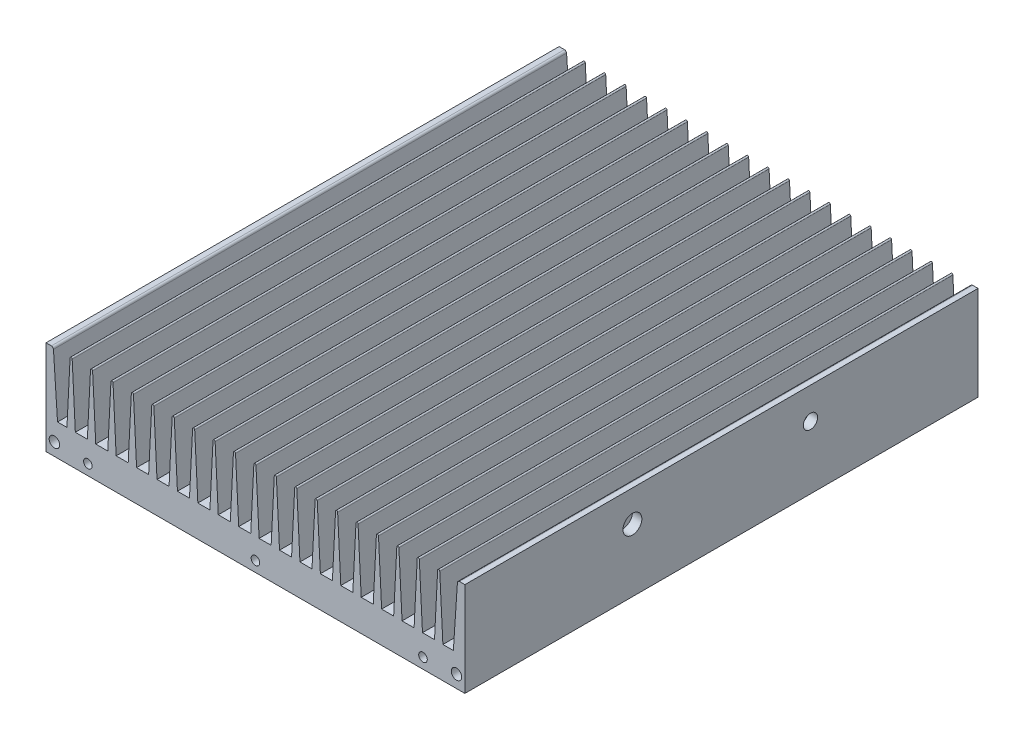
from build123d import *

# Parameters (mm, degrees)
EXTRUDE_1_DEPTH       = 245
EXTRUDE_3_DEPTH       = 245
PATTERN_CURVE_1_COUNT = 19
PATTERN_CURVE_1_PITCH = 9.75
SKETCH_3_R            = 2.05
CUT_EXTRUDE_1_DEPTH   = 10
CUT_EXTRUDE_START     = -10
SKETCH_5_R            = 2.05
CUT_EXTRUDE_2_DEPTH   = 10
SKETCH_6_R            = 2.5
CUT_EXTRUDE_3_DEPTH   = 8
SKETCH_7_R            = 2.6
CUT_EXTRUDE_4_DEPTH   = 6
SKETCH_8_R            = 3.4
SKETCH_8_R_2          = 4.5
CUT_EXTRUDE_5_DEPTH   = 6
CUT_EXTRUDE_START_2   = -8
SKETCH_10_R           = 2.5
CUT_EXTRUDE_7_DEPTH   = 8
SKETCH_12_R           = 1.3
SKETCH_12_R_2         = 1.6
SKETCH_12_R_3         = 2.1
CUT_EXTRUDE_8_DEPTH   = 8


with BuildPart() as part:
    # Эскиз1 → Вытянуть1 (new body)
    with BuildSketch(Plane.XY):
        with BuildLine():
            Line((0, 45), (2.564446908, 45))
            ThreePointArc((2.564446908, 45), (3.247630994, 44.730246195), (3.562232066, 44.066519011))
            Line((3.562232066, 44.066519011), (5.5, 15))
            Line((5.5, 15), (194.5, 15))
            Line((194.5, 15), (196.437767934, 44.066519011))
            ThreePointArc((196.437767934, 44.066519011), (196.752369006, 44.730246195), (197.435553092, 45))
            Line((197.435553092, 45), (200, 45))
            Line((200, 45), (200, 0))
            Line((200, 0), (0, 0))
            Line((0, 0), (0, 45))
        make_face()
    extrude(amount=EXTRUDE_1_DEPTH)

    # Эскиз2 → Вытянуть3 (add)
    with BuildSketch(Plane.XY.offset(245)):
        with BuildLine():
            Line((11.5, 44.5), (10, 15))
            Line((10, 15), (14, 15))
            Line((14, 15), (12.5, 44.5))
            ThreePointArc((12.5, 44.5), (12, 45), (11.5, 44.5))
        make_face()
    extrude_3 = extrude(amount=-EXTRUDE_3_DEPTH)

    # Кривая1: Вытянуть3 ×19
    with Locations(*[(i * PATTERN_CURVE_1_PITCH, 0, 0) for i in range(1, PATTERN_CURVE_1_COUNT)]):
        add(extrude_3)

    # Эскиз3 → Вырез-Вытянуть1 (cut)
    with BuildSketch(Plane.XY.offset(245)):
        with Locations((20, 5)):
            Circle(SKETCH_3_R)
        with Locations((100, 5)):
            Circle(SKETCH_3_R)
        with Locations((180, 5)):
            Circle(SKETCH_3_R)
    extrude(amount=-CUT_EXTRUDE_1_DEPTH, mode=Mode.SUBTRACT)

    # Эскиз5 → Вырез-Вытянуть2 (cut)
    with BuildSketch(Plane(origin=(0, 0, 0), x_dir=(-1, 0, 0), z_dir=(0, 0, -1)).offset(CUT_EXTRUDE_START)):
        with Locations(Location((-180, 5, 0), (0, 0, 180))):
            Circle(SKETCH_5_R)
        with Locations(Location((-100, 5, 0), (0, 0, 180))):
            Circle(SKETCH_5_R)
        with Locations(Location((-20, 5, 0), (0, 0, 180))):
            Circle(SKETCH_5_R)
    extrude(amount=CUT_EXTRUDE_2_DEPTH, mode=Mode.SUBTRACT)

    # Эскиз6 → Вырез-Вытянуть3 (cut)
    with BuildSketch(Plane(origin=(0, 0, 0), x_dir=(-1, 0, 0), z_dir=(0, 0, -1))):
        with Locations((-4, 6)):
            Circle(SKETCH_6_R)
        with Locations(Location((-196, 6, 0), (0, 0, 180))):
            Circle(SKETCH_6_R)
    extrude(amount=-CUT_EXTRUDE_3_DEPTH, mode=Mode.SUBTRACT)

    # Эскиз7 → Вырез-Вытянуть4 (cut)
    with BuildSketch(Plane.ZY):
        with Locations(Location((22.5, 20, 0), (0, 0, 270))):
            Circle(SKETCH_7_R)
        with Locations(Location((222.5, 20, 0), (0, 0, 270))):
            Circle(SKETCH_7_R)
        with Locations(Location((122.5, 20, 0), (0, 0, 270))):
            Circle(SKETCH_7_R)
    extrude(amount=-CUT_EXTRUDE_4_DEPTH, mode=Mode.SUBTRACT)

    # Эскиз8 → Вырез-Вытянуть5 (cut)
    with BuildSketch(Plane(origin=(200, 0, 0), x_dir=(0, 0, -1), z_dir=(1, 0, 0))):
        with Locations((-80, 30)):
            Circle(SKETCH_8_R)
        with Locations((-165, 30)):
            Circle(SKETCH_8_R_2)
    extrude(amount=-CUT_EXTRUDE_5_DEPTH, mode=Mode.SUBTRACT)

    # Эскиз10 → Вырез-Вытянуть7 (cut)
    with BuildSketch(Plane.XY.offset(245).offset(CUT_EXTRUDE_START_2)):
        with Locations((196, 6)):
            Circle(SKETCH_10_R)
        with Locations(Location((4, 6, 0), (0, 0, 180))):
            Circle(SKETCH_10_R)
    extrude(amount=CUT_EXTRUDE_7_DEPTH, mode=Mode.SUBTRACT)

    # Эскиз12 → Вырез-Вытянуть8 (cut)
    with BuildSketch(Plane.XZ):
        with Locations((45.75, 202.5)):
            Circle(SKETCH_12_R)
        with Locations((10, 235)):
            Circle(SKETCH_12_R_2)
        with Locations((10, 125)):
            Circle(SKETCH_12_R_2)
        with Locations((160, 235)):
            Circle(SKETCH_12_R_2)
        with Locations((160, 125)):
            Circle(SKETCH_12_R_2)
        with Locations((75, 225)):
            Circle(SKETCH_12_R_3)
        with Locations((100.5, 203)):
            Circle(SKETCH_12_R)
        with Locations((100.5, 158)):
            Circle(SKETCH_12_R)
        with Locations((130, 203)):
            Circle(SKETCH_12_R)
        with Locations((130, 158)):
            Circle(SKETCH_12_R)
    extrude(amount=-CUT_EXTRUDE_8_DEPTH, mode=Mode.SUBTRACT)


solid = part.part
